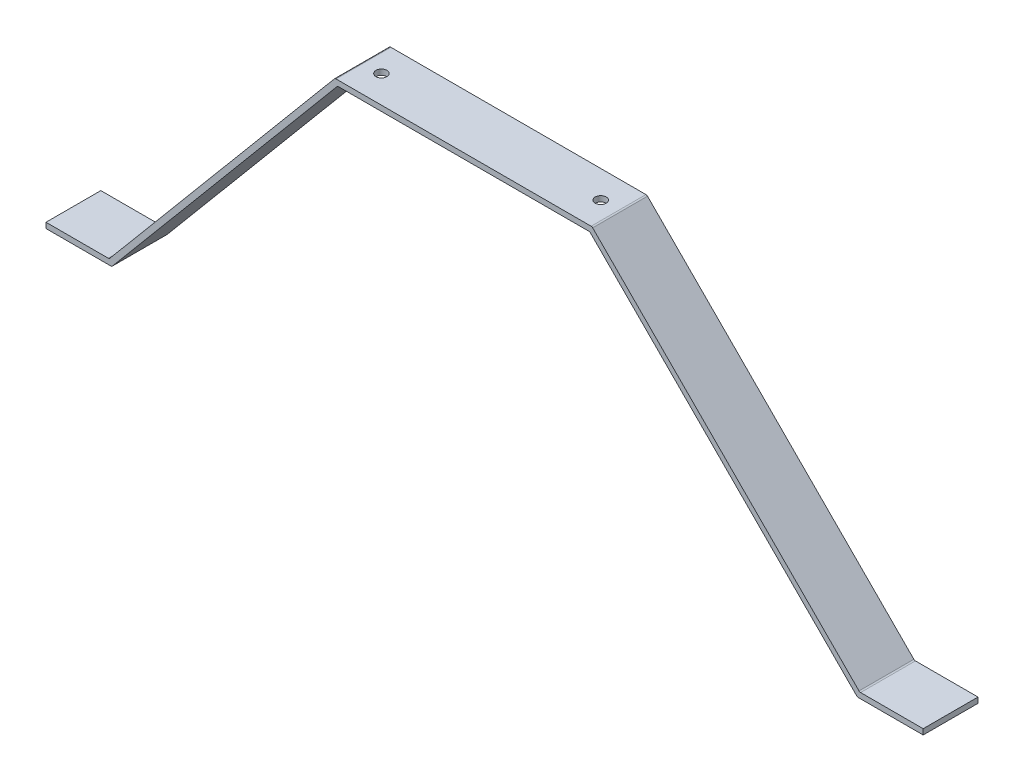
from build123d import *

# Parameters (mm, degrees)
DODANIE_WYCI_GNI_CIE1_DEPTH = 50
ZAOKR_GLENIE1_R             = 2
WYTNIJ_WYCI_GNI_CIE1_REACH  = 841.777
SZKIC2_R                    = 5


with BuildPart() as part:
    # Szkic1 → Dodanie-wyciągnięcie1 (new body)
    with BuildSketch(Plane.XY):
        Polygon((0, 0), (60, 0), (265.92, 245.45), (495.92, 245.45), (740, 0), (800, 0), (800, 5), (742.079269467, 5), (497.999269467, 250.45), (263.588192414, 250.45), (57.668192414, 5), (0, 5), align=None)
    extrude(amount=DODANIE_WYCI_GNI_CIE1_DEPTH)

    # Zaokrąglenie1
    zaokr_glenie1_edges = [part.edges().sort_by_distance(p)[0] for p in [
        (57.668192414, 5, 25),
        (263.588192414, 250.45, 25),
        (497.999269467, 250.45, 25),
        (742.079269467, 5, 25),
        (740, 0, 25),
        (495.92, 245.45, 25),
        (265.92, 245.45, 25),
        (60, 0, 25),
    ]]
    fillet(zaokr_glenie1_edges, radius=ZAOKR_GLENIE1_R)

    # Szkic2 → Wytnij-wyciągnięcie1 (cut, up to next)
    with BuildSketch(Plane(origin=(0, 250.45, 0), x_dir=(1, 0, 0), z_dir=(0, 1, 0)), mode=Mode.PRIVATE) as wytnij_wyci_gni_cie1_sk1:
        with Locations(Location((480.919525398, -24.999999896, 0), (0, 0, 270))):
            Circle(SZKIC2_R)
    wytnij_wyci_gni_cie1_tool1 = extrude(wytnij_wyci_gni_cie1_sk1.sketch, amount=-WYTNIJ_WYCI_GNI_CIE1_REACH, mode=Mode.PRIVATE) & part.part
    # Szkic2 → Wytnij-wyciągnięcie1 (cut, up to next)
    with BuildSketch(Plane(origin=(0, 250.45, 0), x_dir=(1, 0, 0), z_dir=(0, 1, 0)), mode=Mode.PRIVATE) as wytnij_wyci_gni_cie1_sk2:
        with Locations(Location((280.919525398, -24.999999896, 0), (0, 0, 270))):
            Circle(SZKIC2_R)
    wytnij_wyci_gni_cie1_tool2 = extrude(wytnij_wyci_gni_cie1_sk2.sketch, amount=-WYTNIJ_WYCI_GNI_CIE1_REACH, mode=Mode.PRIVATE) & part.part
    add(wytnij_wyci_gni_cie1_tool1.solids().sort_by_distance((480.919525, 250.45, 25))[0], mode=Mode.SUBTRACT)
    add(wytnij_wyci_gni_cie1_tool2.solids().sort_by_distance((280.919525, 250.45, 25))[0], mode=Mode.SUBTRACT)


solid = part.part
